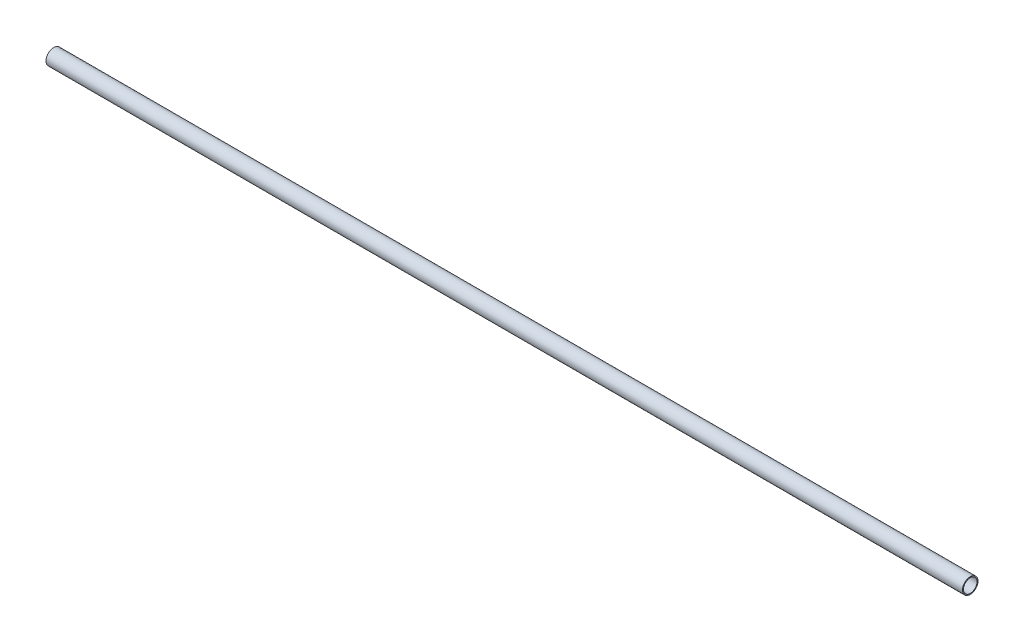
from build123d import *

# Parameters (mm, degrees)
BOSS_EXTRUDE1_DEPTH      = 749.3
BOSS_EXTRUDE1_DEPTH_BACK = 749.3
SKETCH1_R                = 12.7
SKETCH1_R_2              = 11.1125


with BuildPart() as part:
    # Sketch1 → Boss-Extrude1 (new, two sides: drawn at the far end of the back side and taken through both)
    with BuildSketch(Plane(origin=(0, 0, 0), x_dir=(0, 0, -1), z_dir=(1, 0, 0)).offset(-BOSS_EXTRUDE1_DEPTH_BACK)):
        Circle(SKETCH1_R)
        Circle(SKETCH1_R_2, mode=Mode.SUBTRACT)
    extrude(amount=BOSS_EXTRUDE1_DEPTH + BOSS_EXTRUDE1_DEPTH_BACK)


solid = part.part
